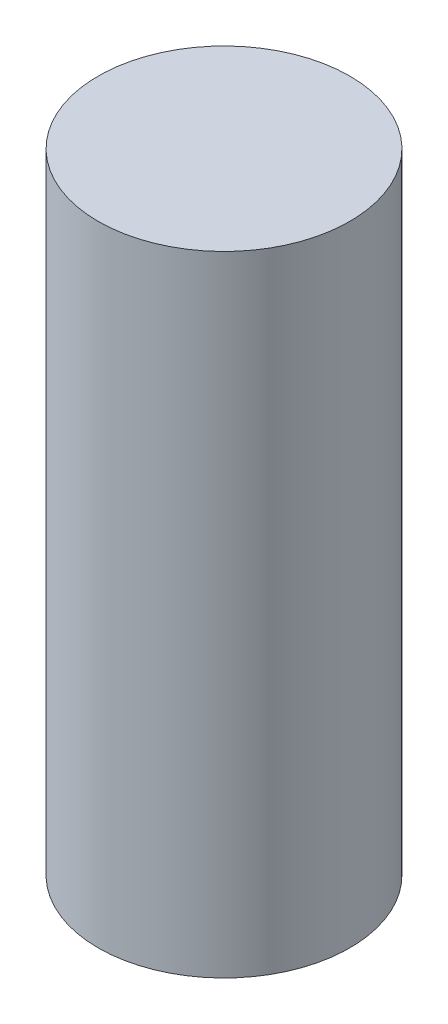
from build123d import *

# Parameters (mm, degrees)
SKETCH1_R           = 2.4
BOSS_EXTRUDE1_DEPTH = 12


with BuildPart() as part:
    # Sketch1 → Boss-Extrude1 (new body)
    with BuildSketch(Plane(origin=(0, 0, 0), x_dir=(1, 0, 0), z_dir=(0, 1, 0))):
        with Locations(Location((0, 0, 0), (0, 0, 270))):
            Circle(SKETCH1_R)
    extrude(amount=BOSS_EXTRUDE1_DEPTH)


solid = part.part
